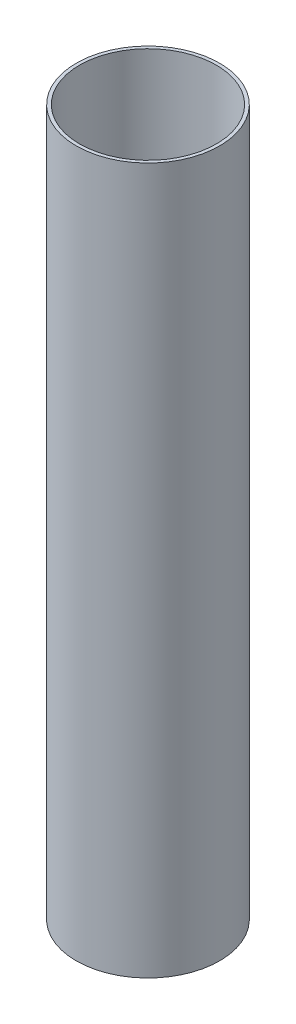
from build123d import *

# Parameters (mm, degrees)
SKETCH_1_R          = 32.5
EXTRUDE_1_DEPTH     = 320
SKETCH_2_R          = 31
CUT_EXTRUDE_1_DEPTH = 324.283930934


with BuildPart() as part:
    # 草图1 → 凸台-拉伸1 (new body)
    with BuildSketch(Plane(origin=(0, 0, 0), x_dir=(1, 0, 0), z_dir=(0, 1, 0))):
        with Locations(Location((0, 0, 0), (0, 0, 270))):
            Circle(SKETCH_1_R)
    extrude(amount=EXTRUDE_1_DEPTH)

    # 草图2 → 切除-拉伸1 (cut, through all)
    with BuildSketch(Plane(origin=(0, 320, 0), x_dir=(1, 0, 0), z_dir=(0, 1, 0))):
        with Locations(Location((0, 0, 0), (0, 0, 270))):
            Circle(SKETCH_2_R)
    extrude(amount=-CUT_EXTRUDE_1_DEPTH, mode=Mode.SUBTRACT)


solid = part.part
